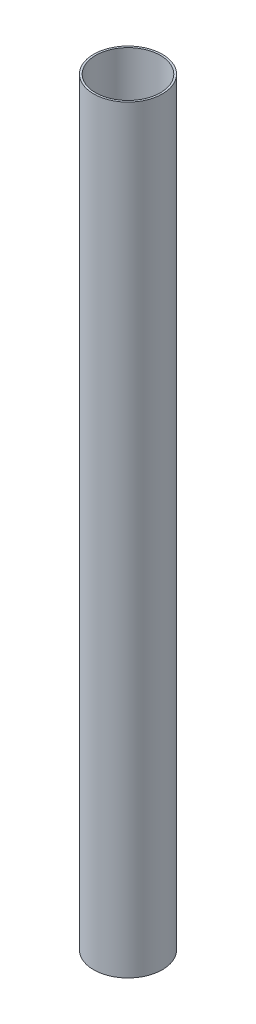
from build123d import *

# Parameters (mm, degrees)
SKETCH1_R           = 26.9875
SKETCH1_R_2         = 25.4635
BOSS_EXTRUDE1_DEPTH = 595.7316


with BuildPart() as part:
    # Sketch1 → Boss-Extrude1 (new body)
    with BuildSketch(Plane(origin=(0, 0, 0), x_dir=(1, 0, 0), z_dir=(0, 1, 0))):
        with Locations(Location((0, 0, 0), (0, 0, 270))):
            Circle(SKETCH1_R)
        with Locations(Location((0, 0, 0), (0, 0, 270))):
            Circle(SKETCH1_R_2, mode=Mode.SUBTRACT)
    extrude(amount=BOSS_EXTRUDE1_DEPTH)


solid = part.part
